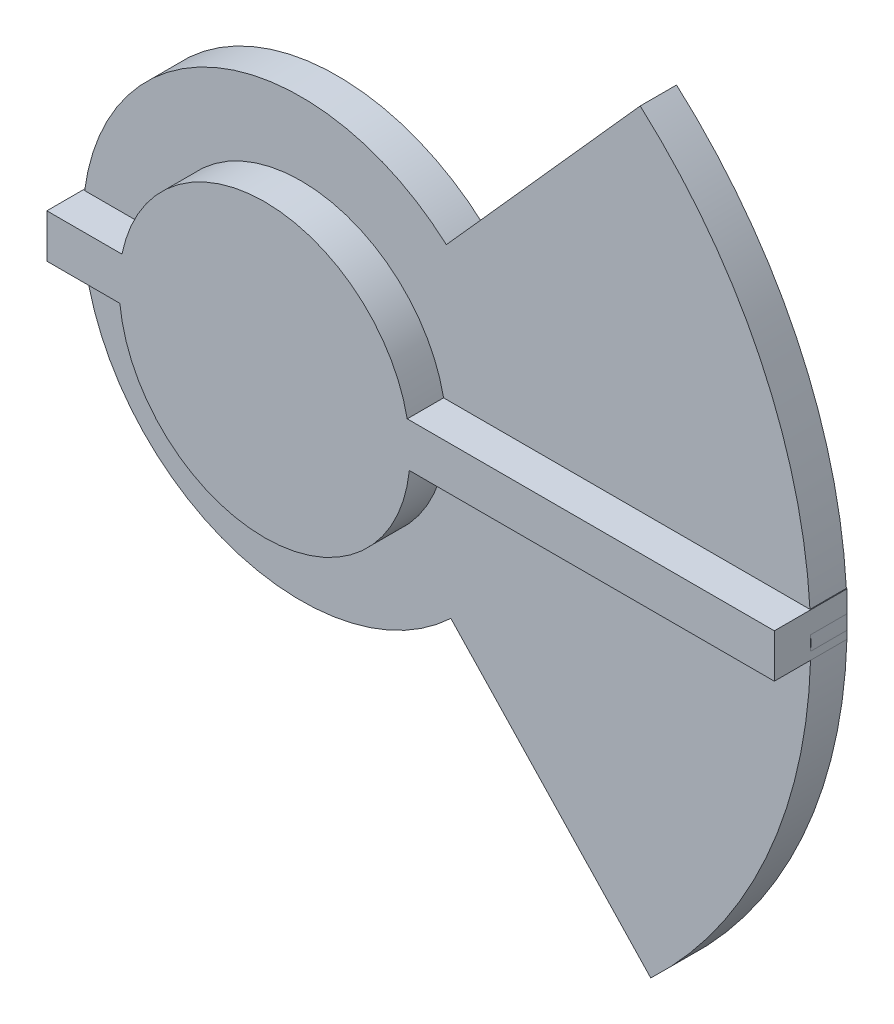
from build123d import *

# Parameters (mm, degrees)
SKETCH3_R           = 20
SKETCH3_W           = 100
SKETCH3_H           = 6
BOSS_EXTRUDE3_DEPTH = 10
SKETCH5_R           = 30
BOSS_EXTRUDE4_DEPTH = 5


with BuildPart() as part:
    # Sketch3 → Boss-Extrude3 (new body)
    with BuildSketch(Plane.XY):
        with Locations((-20.605993479, -1.21989897)):
            Circle(SKETCH3_R)
        with Locations((-0.535964706, -0.268513697)):
            Rectangle(SKETCH3_W, SKETCH3_H)
    extrude(amount=BOSS_EXTRUDE3_DEPTH)

    # Sketch5 → Boss-Extrude4 (add)
    with BuildSketch(Plane.XY):
        with BuildLine():
            Line((26.021713598, 50.989840857), (-0.622690446, 21.155703813))
            ThreePointArc((-0.622690446, 21.155703813), (6.775561362, 11.037770242), (9.394006521, -1.21989897))
            ThreePointArc((9.394006521, -1.21989897), (6.945592722, -13.090454889), (0, -23.023408613))
            Line((0, -23.023408613), (27.474657971, -52.094754804))
            ThreePointArc((27.474657971, -52.094754804), (49.464035294, -0.232284347), (26.021713598, 50.989840857))
        make_face()
        with Locations((-20.605993479, -1.21989897)):
            Circle(SKETCH5_R)
    extrude(amount=BOSS_EXTRUDE4_DEPTH)


solid = part.part
